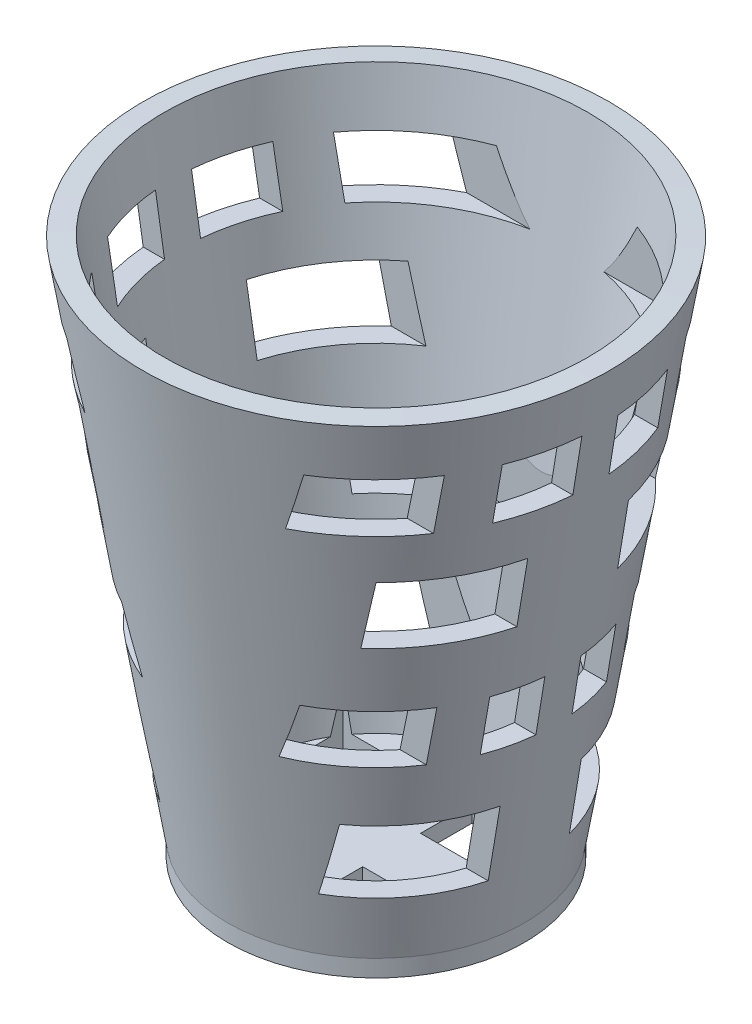
from build123d import *

# Parameters (mm, degrees)
SKETCH2_W          = 5.313763674
SKETCH2_H          = 6.465079137
SKETCH2_W_2        = 8.236333695
SKETCH2_H_2        = 6.553641866
SKETCH2_W_3        = 7.6163946
SKETCH2_W_4        = 11.4245919
SKETCH2_H_3        = 7.6163946
SKETCH2_W_5        = 7.837801419
SKETCH2_W_6        = 11.336029172
SKETCH2_H_4        = 8.324896423
CUT_EXTRUDE1_DEPTH = 37.5
SKETCH3_W          = 8.58343696
SKETCH3_H          = 6.05438857
SKETCH3_W_2        = 7.43386951
SKETCH3_H_2        = 5.44128593
SKETCH3_H_3        = 4.90482112
CUT_EXTRUDE2_DEPTH = 5


with BuildPart() as part:
    # Sketch1 → Revolve1 (revolve)
    with BuildSketch(Plane.XY, mode=Mode.PRIVATE) as revolve1_sk:
        Polygon((25, 61.505495407), (27.477266543, 61.365672154), (17.5, 0), (15, 0), align=None)
        Polygon((17.5, 0), (15, 0), (0, 0), (0, -2), (17.5, -2), align=None)
    revolve(revolve1_sk.sketch.rotate(Axis((0, 0, 0), (0, 1, 0)), 90), axis=Axis((0, 0, 0), (0, 1, 0)))

    # Sketch2 → Cut-Extrude1 (cut, symmetric)
    with BuildSketch(Plane(origin=(0, 0, 0), x_dir=(0, 0, -1), z_dir=(1, 0, 0))):
        with Locations((4.782387307, 25.236048581)):
            Rectangle(SKETCH2_W, SKETCH2_H)
        with Locations((-18.376766041, 51.937711044)):
            Rectangle(SKETCH2_W_2, SKETCH2_H_2)
        with Locations((-5.93370277, 51.937711044)):
            Rectangle(SKETCH2_W_3, SKETCH2_H_2)
        with Locations((-11.64599872, 39.538929137)):
            Rectangle(SKETCH2_W_4, SKETCH2_H_3)
        with Locations((-15.56489943, 25.236048581)):
            Rectangle(SKETCH2_W_5, SKETCH2_H)
        with Locations((-4.782387307, 25.236048581)):
            Rectangle(SKETCH2_W, SKETCH2_H)
        with Locations((-10.450401893, 11.11029348)):
            Rectangle(SKETCH2_W_6, SKETCH2_H_4)
        with Locations((5.93370277, 51.937711044)):
            Rectangle(SKETCH2_W_3, SKETCH2_H_2)
        with Locations((10.450401893, 11.11029348)):
            Rectangle(SKETCH2_W_6, SKETCH2_H_4)
        with Locations((15.56489943, 25.236048581)):
            Rectangle(SKETCH2_W_5, SKETCH2_H)
        with Locations((11.64599872, 39.538929137)):
            Rectangle(SKETCH2_W_4, SKETCH2_H_3)
        with Locations((18.376766041, 51.937711044)):
            Rectangle(SKETCH2_W_2, SKETCH2_H_2)
    extrude(amount=CUT_EXTRUDE1_DEPTH, both=True, mode=Mode.SUBTRACT)

    # Sketch3 → Cut-Extrude2 (cut)
    with BuildSketch(Plane.XZ.offset(2)):
        with Locations((6.51421555, -6.05438857)):
            Rectangle(SKETCH3_W, SKETCH3_H)
        with Locations((-9.234858515, -6.05438857)):
            Rectangle(SKETCH3_W_2, SKETCH3_H)
        with Locations((6.51421555, 6.51421555)):
            Rectangle(SKETCH3_W, SKETCH3_H_2)
        with Locations((-9.234858515, 6.782447955)):
            Rectangle(SKETCH3_W_2, SKETCH3_H_3)
    extrude(amount=-CUT_EXTRUDE2_DEPTH, mode=Mode.SUBTRACT)


solid = part.part
